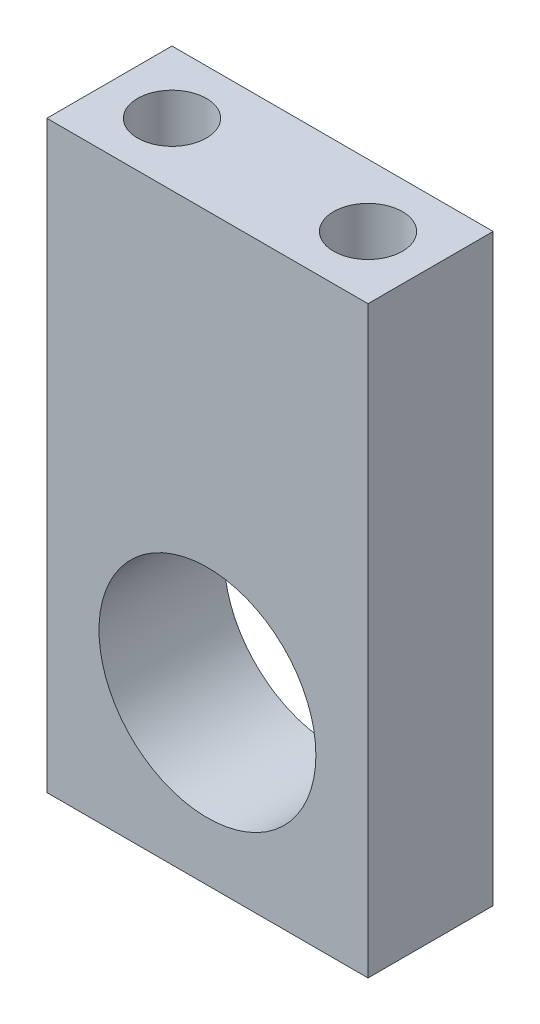
from build123d import *

# Parameters (mm, degrees)
SKETCH1_W                                     = 15.4
SKETCH1_H                                     = 6
BOSS_EXTRUDE1_DEPTH                           = 28
TAP_DRILL_FOR_M4X0_7_TAP1_D                   = 3.3
TAP_DRILL_FOR_M4X0_7_TAP1_DEPTH               = 13.4
TAP_DRILL_FOR_M4X0_7_TAP1_TIP                 = 0.991420021
CUT_EXTRUDE_PRESS_FIT_HOLE_FOR_SOLENOID_REACH = 31.653
SKETCH4_R                                     = 5.2


with BuildPart() as part:
    # Sketch1 → Boss-Extrude1 (new body)
    with BuildSketch(Plane(origin=(0, 0, 0), x_dir=(1, 0, 0), z_dir=(0, 1, 0))):
        Rectangle(SKETCH1_W, SKETCH1_H)
    extrude(amount=BOSS_EXTRUDE1_DEPTH)

    # Tap Drill for M4x0.7 Tap1
    with Locations(Plane(origin=(-4.7, 28, 0), x_dir=(0, 0, 1), z_dir=(0, 1, 0))):
        with Locations((0, 0), (0, 9.4)):
            Hole(TAP_DRILL_FOR_M4X0_7_TAP1_D / 2, depth=TAP_DRILL_FOR_M4X0_7_TAP1_DEPTH)
            with Locations((0, 0, -(TAP_DRILL_FOR_M4X0_7_TAP1_DEPTH + TAP_DRILL_FOR_M4X0_7_TAP1_TIP / 2))):  # 118° drill point
                Cone(0, TAP_DRILL_FOR_M4X0_7_TAP1_D / 2, TAP_DRILL_FOR_M4X0_7_TAP1_TIP, mode=Mode.SUBTRACT)

    # Sketch4 → Cut-Extrude Press Fit hole for solenoid tube (cut, up to next)
    with BuildSketch(Plane.XY.offset(3), mode=Mode.PRIVATE) as cut_extrude_press_fit_hole_for_solenoid_sk1:
        with Locations((0, 8)):
            Circle(SKETCH4_R)
    cut_extrude_press_fit_hole_for_solenoid_tool1 = extrude(cut_extrude_press_fit_hole_for_solenoid_sk1.sketch, amount=-CUT_EXTRUDE_PRESS_FIT_HOLE_FOR_SOLENOID_REACH, mode=Mode.PRIVATE) & part.part
    add(cut_extrude_press_fit_hole_for_solenoid_tool1.solids().sort_by_distance((0, 8, 3))[0], mode=Mode.SUBTRACT)


solid = part.part
